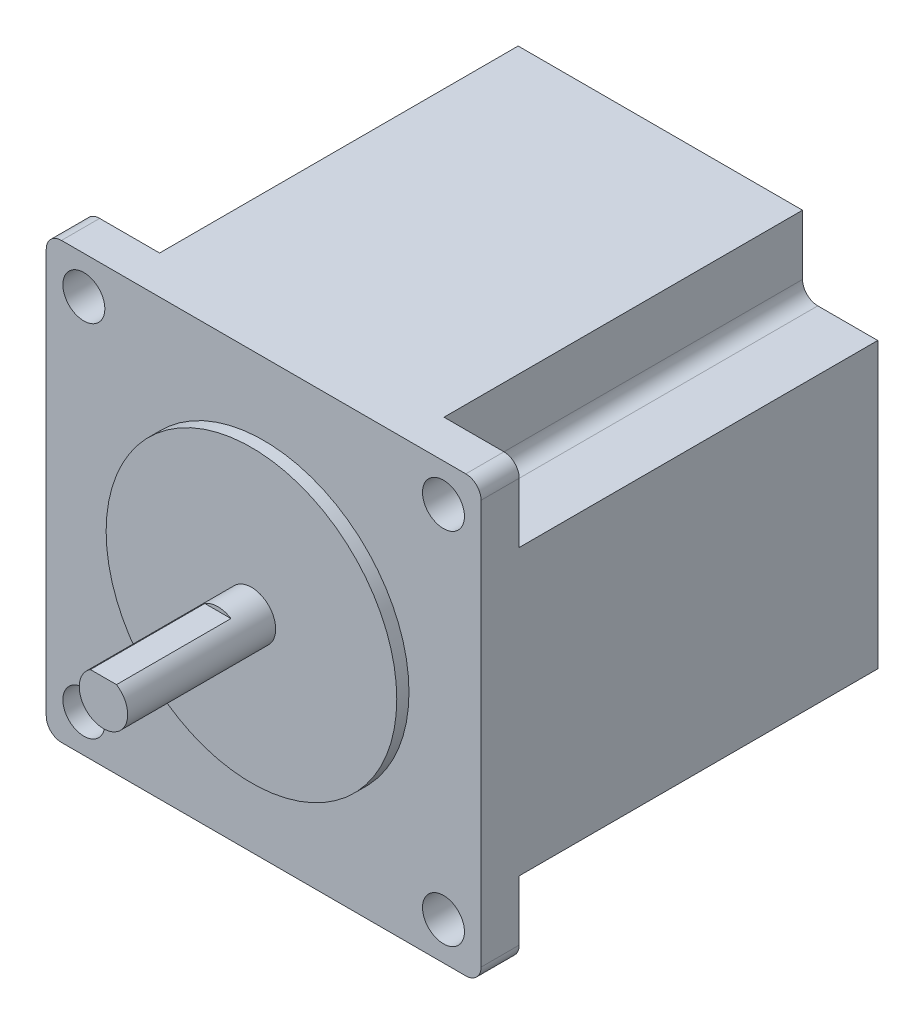
from build123d import *

# Parameters (mm, degrees)
SKETCH1_W                = 57
SKETCH1_H                = 57
BOSS_EXTRUDE1_DEPTH      = 52
SKETCH2_R                = 3.175
BOSS_EXTRUDE2_DEPTH      = 21
FILLET1_R                = 2
SKETCH9_R                = 19.05
BOSS_EXTRUDE3_DEPTH      = 1.6
SKETCH11_R               = 2.75
CUT_EXTRUDE3_DEPTH       = 66.791336816
CUT_EXTRUDE2_START       = -15
CUT_EXTRUDE2_DEPTH       = 15
SKETCH12_W               = 9.86
SKETCH12_H               = 9.86
CUT_EXTRUDE4_DEPTH       = 47
FILLET2_R                = 2
CIRPATTERN1_COUNT        = 4
FILLET2_OF_CIRPATTERN1_R = 2


with BuildPart() as part:
    # Sketch1 → Boss-Extrude1 (new body)
    with BuildSketch(Plane.XY):
        Rectangle(SKETCH1_W, SKETCH1_H)
    extrude(amount=BOSS_EXTRUDE1_DEPTH)

    # Sketch2 → Boss-Extrude2 (add)
    with BuildSketch(Plane.XY.offset(52)):
        with Locations(Location((0, 0, 0), (0, 0, 180))):
            Circle(SKETCH2_R)
    extrude(amount=BOSS_EXTRUDE2_DEPTH)

    # Fillet1
    fillet1_edges = [part.edges().sort_by_distance(p)[0] for p in [
        (28.5, -28.5, 26),
        (-28.5, -28.5, 26),
        (-28.5, 28.5, 26),
        (28.5, 28.5, 26),
    ]]
    fillet(fillet1_edges, radius=FILLET1_R)

    # Sketch9 → Boss-Extrude3 (add)
    with BuildSketch(Plane.XY.offset(52)):
        with Locations(Location((0, 0, 0), (0, 0, 180))):
            Circle(SKETCH9_R)
    extrude(amount=BOSS_EXTRUDE3_DEPTH)

    # Sketch11 → Cut-Extrude3 (cut, through all)
    with BuildSketch(Plane.XY.offset(52)):
        with Locations((23.57, 23.57)):
            Circle(SKETCH11_R)
        with Locations((23.57, -23.57)):
            Circle(SKETCH11_R)
        with Locations((-23.57, -23.57)):
            Circle(SKETCH11_R)
        with Locations((-23.57, 23.57)):
            Circle(SKETCH11_R)
    extrude(amount=-CUT_EXTRUDE3_DEPTH, mode=Mode.SUBTRACT)

    # Sketch10 → Cut-Extrude2 (cut)
    with BuildSketch(Plane.XY.offset(73).offset(CUT_EXTRUDE2_START)):
        with BuildLine():
            Line((-1.710263138, 2.675), (1.710263138, 2.675))
            ThreePointArc((1.710263138, 2.675), (0, 3.175), (-1.710263138, 2.675))
        make_face()
    extrude(amount=CUT_EXTRUDE2_DEPTH, mode=Mode.SUBTRACT)

    # Sketch12 → Cut-Extrude4 (cut)
    with BuildSketch(Plane(origin=(0, 0, 0), x_dir=(-1, 0, 0), z_dir=(0, 0, -1))):
        with Locations((-23.57, 23.57)):
            Rectangle(SKETCH12_W, SKETCH12_H)
    cut_extrude4 = extrude(amount=-CUT_EXTRUDE4_DEPTH, mode=Mode.SUBTRACT)

    # Fillet2
    fillet2_edges = [part.edges().sort_by_distance(p)[0] for p in [
        (18.64, 18.64, 23.5),
    ]]
    fillet(fillet2_edges, radius=FILLET2_R)

    # CirPattern1: Cut-Extrude4 ×4 about axis
    cirpattern1_axis = Axis((0, 0, 0), (0, 0, 1))
    for i in range(1, CIRPATTERN1_COUNT):
        add(cut_extrude4.rotate(cirpattern1_axis, i * 360 / CIRPATTERN1_COUNT), mode=Mode.SUBTRACT)

    # Fillet2 of CirPattern1
    fillet2_of_cirpattern1_edges = [part.edges().sort_by_distance(p)[0] for p in [
        (-18.64, 18.64, 23.5),
        (-18.64, -18.64, 23.5),
        (18.64, -18.64, 23.5),
    ]]
    fillet(fillet2_of_cirpattern1_edges, radius=FILLET2_OF_CIRPATTERN1_R)


solid = part.part
